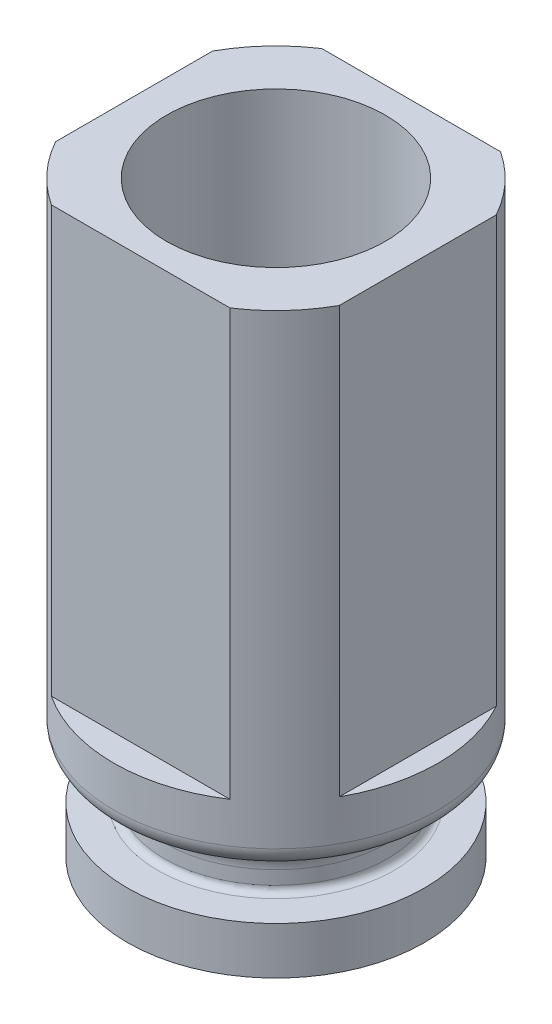
from build123d import *

# Parameters (mm, degrees)
SKETCH_1_R                 = 22
EXTRUDE_1_DEPTH            = 15
SKETCH_2_R                 = 14.5
CUT_EXTRUDE_2_DEPTH        = 6.5
SKETCH_4_R                 = 25
SKETCH_4_R_2               = 16.5
CUT_EXTRUDE_1_DEPTH        = 8
SKETCH_5_R                 = 24
SKETCH_5_R_2               = 16.2
EXTRUDE_4_DEPTH            = 72
FILLET_1_R                 = 1
FILLET_2_R                 = 5
FILLET_3_R                 = 3
CUT_EXTRUDE_2_2_DEPTH      = 50
CUT_EXTRUDE_2_2_DEPTH_BACK = 26
CUT_EXTRUDE_2_2_START      = 50
SKETCH_6_W                 = 42
SKETCH_6_H                 = 40.064513034


with BuildPart() as part:
    # Эскиз1 → Вытянуть1 (new body)
    with BuildSketch(Plane(origin=(0, 0, 0), x_dir=(1, 0, 0), z_dir=(0, 1, 0))):
        with Locations(Location((0, 0, 0), (0, 0, 270))):
            Circle(SKETCH_1_R)
    extrude(amount=EXTRUDE_1_DEPTH)

    # Эскиз2 → Cut-Extrude 2 (cut)
    with BuildSketch(Plane.XZ):
        with Locations(Location((0, 0, 0), (0, 0, 270))):
            Circle(SKETCH_2_R)
    extrude(amount=-CUT_EXTRUDE_2_DEPTH, mode=Mode.SUBTRACT)

    # Эскиз4 → Вырез-Вытянуть1 (cut)
    with BuildSketch(Plane(origin=(0, 15, 0), x_dir=(1, 0, 0), z_dir=(0, 1, 0))):
        Circle(SKETCH_4_R)
        with Locations(Location((0, 0, 0), (0, 0, 270))):
            Circle(SKETCH_4_R_2, mode=Mode.SUBTRACT)
    extrude(amount=-CUT_EXTRUDE_1_DEPTH, mode=Mode.SUBTRACT)

    # Эскиз5 → Вытянуть4 (add)
    with BuildSketch(Plane(origin=(0, 15, 0), x_dir=(1, 0, 0), z_dir=(0, 1, 0))):
        with Locations(Location((0, 0, 0), (0, 0, 270))):
            Circle(SKETCH_5_R)
        with Locations(Location((0, 0, 0), (0, 0, 270))):
            Circle(SKETCH_5_R_2, mode=Mode.SUBTRACT)
    extrude(amount=EXTRUDE_4_DEPTH)

    # Скругление1
    fillet_1_edges = [part.edges().sort_by_distance(p)[0] for p in [
        (0, 7, -16.5),
    ]]
    fillet(fillet_1_edges, radius=FILLET_1_R)

    # Скругление2
    fillet_2_edges = [part.edges().sort_by_distance(p)[0] for p in [
        (0, 15, -16.5),
    ]]
    fillet(fillet_2_edges, radius=FILLET_2_R)

    # Скругление3
    fillet_3_edges = [part.edges().sort_by_distance(p)[0] for p in [
        (0, 15, -24),
    ]]
    fillet(fillet_3_edges, radius=FILLET_3_R)

    # Эскиз6 → Cut-Extrude 2 2 (cut, two sides: drawn at the far end of the back side and taken through both)
    with BuildSketch(Plane(origin=(0, 0, 0), x_dir=(1, 0, 0), z_dir=(0, 1, 0)).offset(CUT_EXTRUDE_2_2_START - CUT_EXTRUDE_2_2_DEPTH_BACK)):
        Polygon((21, 29.701884449), (36.425926694, 29.701884449), (36.425926694, -29.522725679), (-36.425926694, -29.522725679), (-36.425926694, 29.701884449), (-21, 29.701884449), align=None)
        Rectangle(SKETCH_6_W, SKETCH_6_H, mode=Mode.SUBTRACT)
    extrude(amount=CUT_EXTRUDE_2_2_DEPTH + CUT_EXTRUDE_2_2_DEPTH_BACK, mode=Mode.SUBTRACT)


solid = part.part
